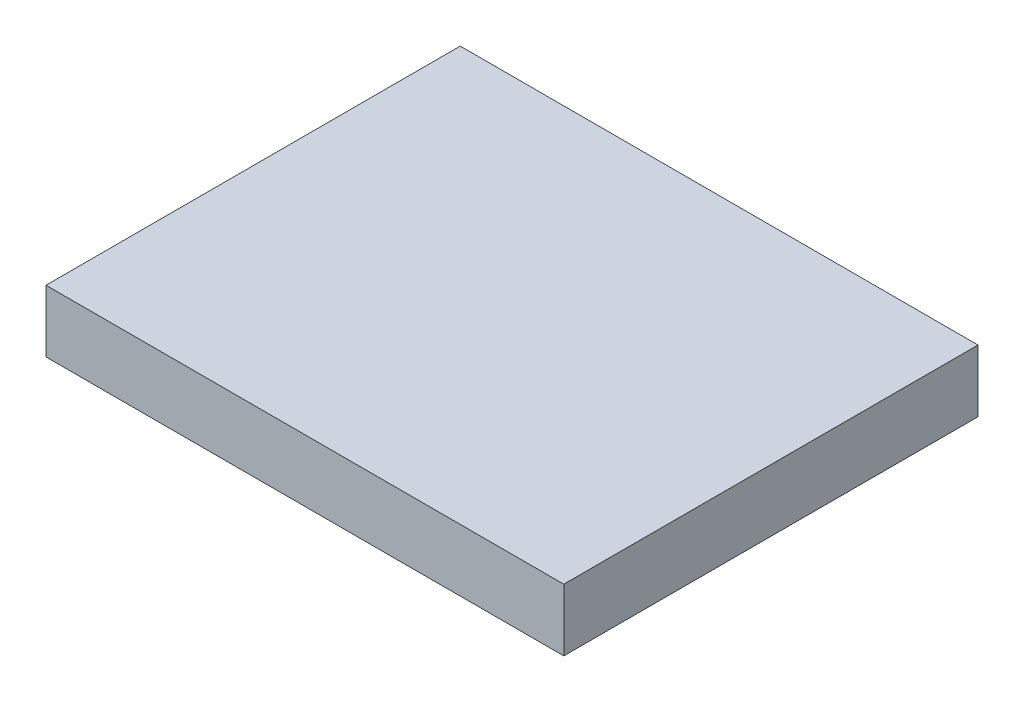
from build123d import *

# Parameters (mm, degrees)
SKETCH1_W           = 25
SKETCH1_H           = 20
BOSS_EXTRUDE1_DEPTH = 3


with BuildPart() as part:
    # Sketch1 → Boss-Extrude1 (new body)
    with BuildSketch(Plane(origin=(0, 0, 0), x_dir=(1, 0, 0), z_dir=(0, 1, 0))):
        Rectangle(SKETCH1_W, SKETCH1_H)
    extrude(amount=BOSS_EXTRUDE1_DEPTH)


solid = part.part
